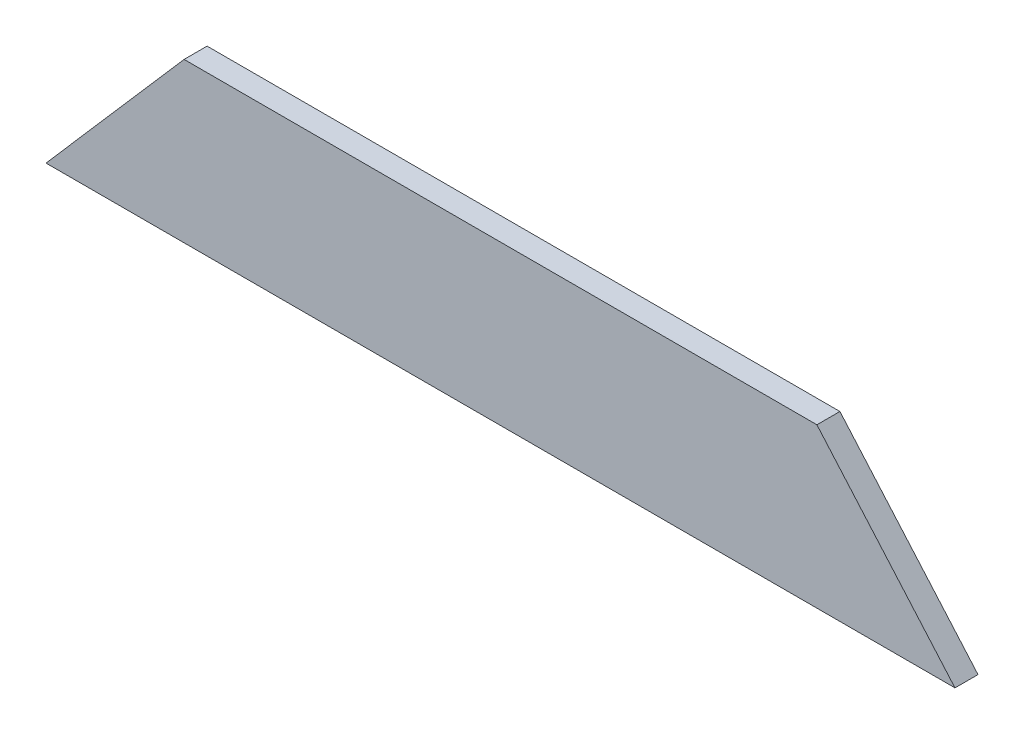
from build123d import *

# Parameters (mm, degrees)
Y_KSEKLIK_EKSTR_ZYON1_DEPTH = 2


with BuildPart() as part:
    # Çizim2 → Yükseklik-Ekstrüzyon1 (new body)
    with BuildSketch(Plane.XY):
        Polygon((0, 0), (79, 0), (67, 13.804420887), (12, 13.804420887), align=None)
    extrude(amount=Y_KSEKLIK_EKSTR_ZYON1_DEPTH)


solid = part.part
